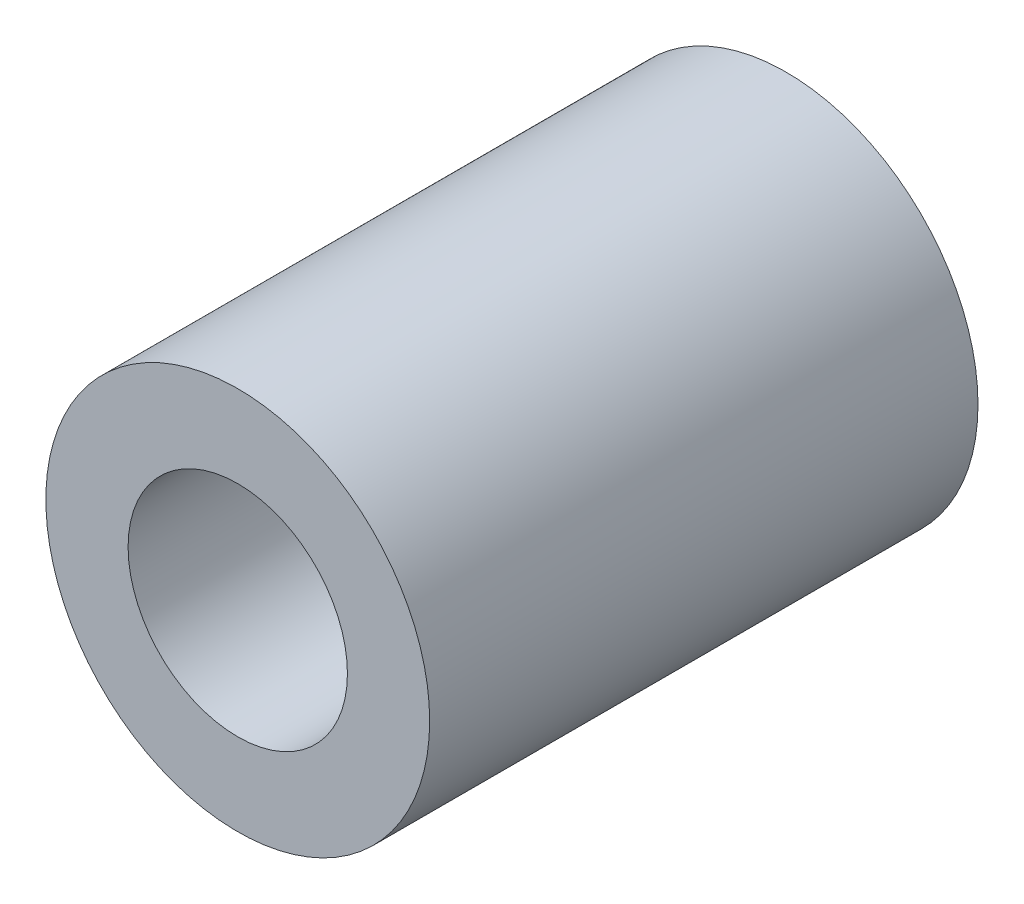
from build123d import *

# Parameters (mm, degrees)
SKETCH_1_R      = 10.5
SKETCH_1_R_2    = 6
EXTRUDE_1_DEPTH = 30


with BuildPart() as part:
    # Эскиз1 → Бобышка-Вытянуть1 (new body)
    with BuildSketch(Plane.XY):
        Circle(SKETCH_1_R)
        Circle(SKETCH_1_R_2, mode=Mode.SUBTRACT)
    extrude(amount=EXTRUDE_1_DEPTH)


solid = part.part
